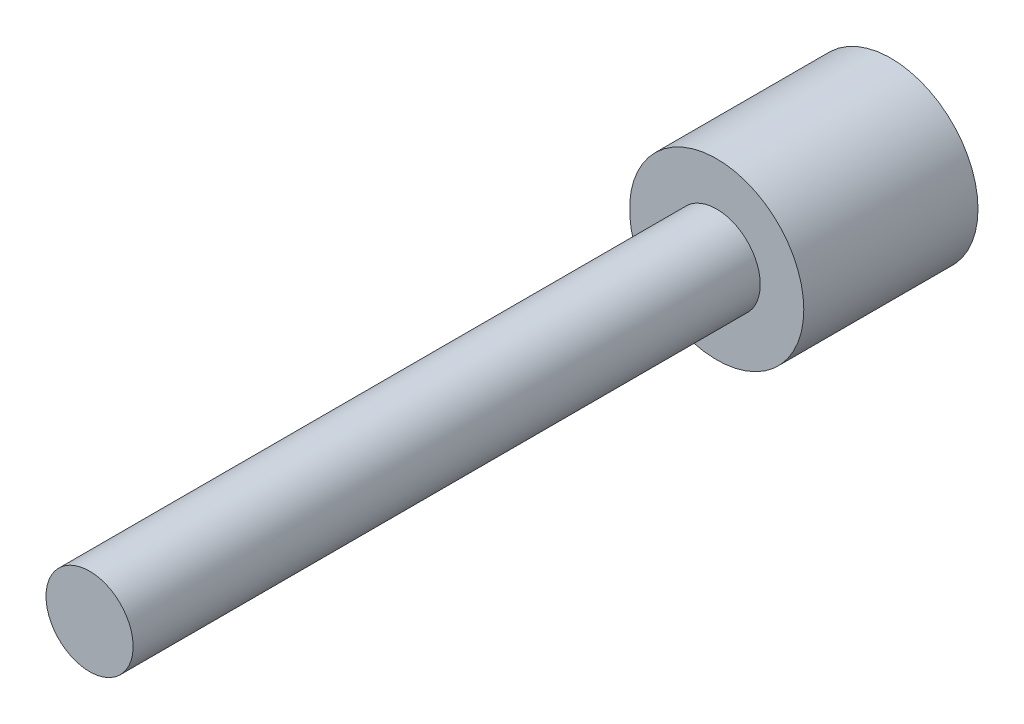
from build123d import *
from build123d.topology import SkipClean

# Parameters (mm, degrees)
ESQUISSE1_R             = 5
BASE_EXTRUSION_DEPTH    = 10
ESQUISSE2_R             = 2.5
BOSS_EXTRU_1_DEPTH      = 46
PER_AGE1_D              = 5
PER_AGE1_DEPTH          = 7
PER_AGE1_TIP            = 1.502151548
BOSS_EXTRU_2_DEPTH      = 5
ENL_V_MAT_EXTRU_1_DEPTH = 47.673600495


with BuildPart() as part:
    # Esquisse1 → Base-Extrusion (new body)
    with BuildSketch(Plane.XY):
        Circle(ESQUISSE1_R)
    extrude(amount=BASE_EXTRUSION_DEPTH)

    # Esquisse2 → Boss.-Extru.1 (add)
    with BuildSketch(Plane(origin=(0, 0, 0), x_dir=(-1, 0, 0), z_dir=(0, 0, -1))):
        Circle(ESQUISSE2_R)
    extrude(amount=-BOSS_EXTRU_1_DEPTH)

    # Perçage1
    with Locations(Plane(origin=(0, 0, 0), x_dir=(-1, 0, 0), z_dir=(0, 0, -1))):
        with Locations((0, 0)):
            Hole(PER_AGE1_D / 2, depth=PER_AGE1_DEPTH)
            with Locations((0, 0, -(PER_AGE1_DEPTH + PER_AGE1_TIP / 2))):  # 118° drill point
                Cone(0, PER_AGE1_D / 2, PER_AGE1_TIP, mode=Mode.SUBTRACT)

    # Esquisse5 → Boss.-Extru.2 (add)
    with BuildSketch(Plane(origin=(0, 0, 0), x_dir=(-1, 0, 0), z_dir=(0, 0, -1))):
        with BuildLine():
            Line((4.34918251, 2.466700528), (6.117596195, 2.466700528))
            Line((6.117596195, 2.466700528), (6.117596195, -2.226545612))
            Line((6.117596195, -2.226545612), (4.476884479, -2.226545612))
            ThreePointArc((4.476884479, -2.226545612), (4.998150103, 0.135998324), (4.34918251, 2.466700528))
        make_face()
    extrude(amount=-BOSS_EXTRU_2_DEPTH)

    # Esquisse8 → Enlèv. mat.-Extru.1 (cut, through all)
    with SkipClean():  # the faces are left unmerged after this step: merging them gives an invalid solid
        with BuildSketch(Plane(origin=(0, 0, 0), x_dir=(-1, 0, 0), z_dir=(0, 0, -1))):
            with BuildLine():
                Line((4.118975402, 2.834438505), (6.634265665, 2.834438505))
                Line((6.634265665, 2.834438505), (6.634265665, -2.731049489))
                Line((6.634265665, -2.731049489), (4.188241718, -2.731049489))
                ThreePointArc((4.188241718, -2.731049489), (4.999612807, 0.062223612), (4.118975402, 2.834438505))
            make_face()
        extrude(amount=-ENL_V_MAT_EXTRU_1_DEPTH, mode=Mode.SUBTRACT)


solid = part.part
